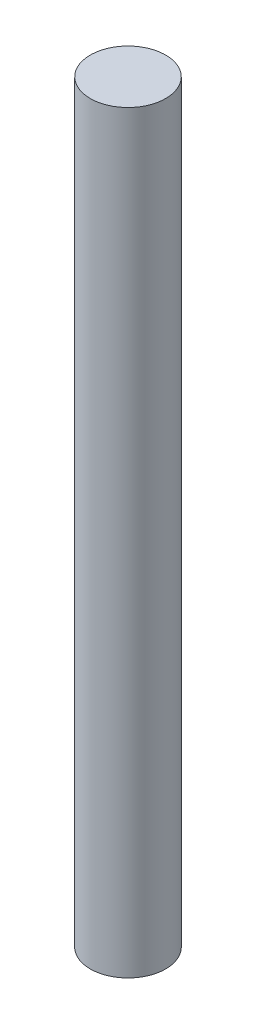
from build123d import *

# Parameters (mm, degrees)
SKETCH1_R           = 4.7625
BOSS_EXTRUDE1_DEPTH = 95.25


with BuildPart() as part:
    # Sketch1 → Boss-Extrude1 (new body)
    with BuildSketch(Plane(origin=(0, 0, 0), x_dir=(1, 0, 0), z_dir=(0, 1, 0))):
        with Locations(Location((0, 0, 0), (0, 0, 270))):
            Circle(SKETCH1_R)
    extrude(amount=-BOSS_EXTRUDE1_DEPTH)


solid = part.part
